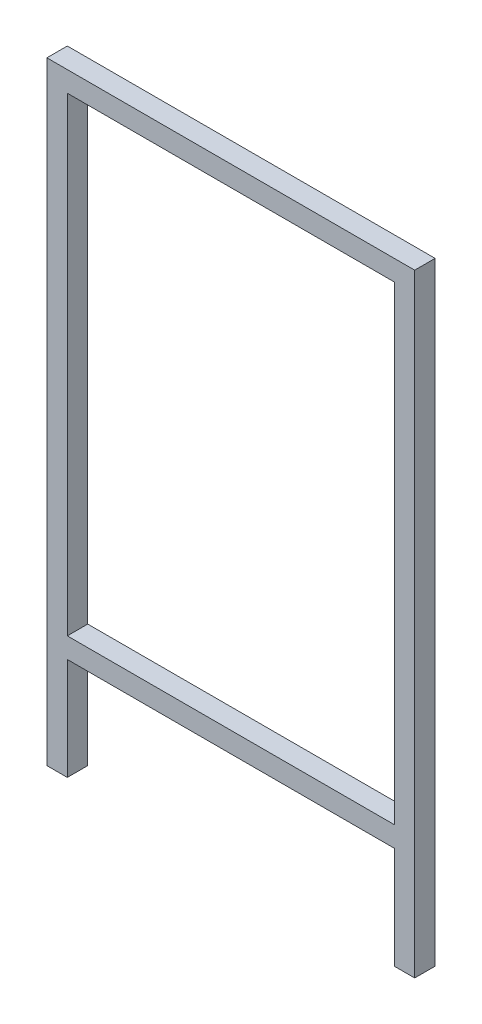
from build123d import *

# Parameters (mm, degrees)
SKETCH1_W           = 320
SKETCH1_H           = 460
BOSS_EXTRUDE1_DEPTH = 10


with BuildPart() as part:
    # Sketch1 → Boss-Extrude1 (new, symmetric)
    with BuildSketch(Plane.XY):
        Polygon((-180, -600), (-180, 0), (180, 0), (180, -600), (160, -600), (160, -500), (-160, -500), (-160, -600), align=None)
        with Locations((0, -250)):
            Rectangle(SKETCH1_W, SKETCH1_H, mode=Mode.SUBTRACT)
    extrude(amount=BOSS_EXTRUDE1_DEPTH, both=True)


solid = part.part
